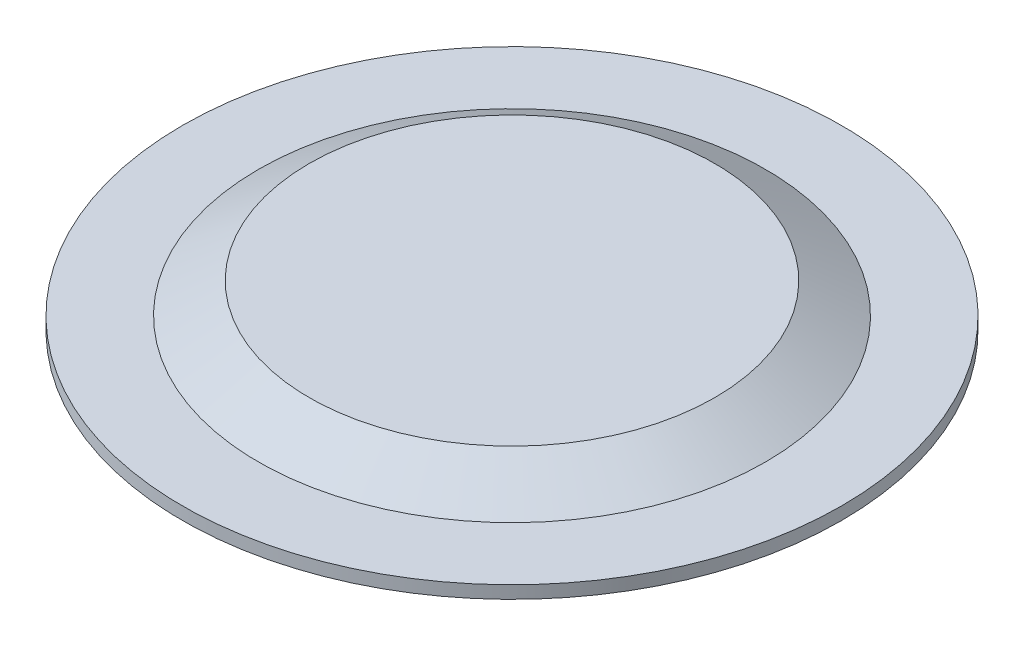
from build123d import *


with BuildPart() as part:
    # Sketch1 → Revolve1 (revolve)
    with BuildSketch(Plane.XY, mode=Mode.PRIVATE) as revolve1_sk:
        Polygon((-16.51, 0), (-12.524115182, 0), (-9.984115182, 1.524), (0, 1.524), (0, 2.159), (-10.16, 2.159), (-12.7, 0.635), (-16.51, 0.635), align=None)
    revolve(revolve1_sk.sketch.rotate(Axis((0, 0, 0), (0, 1, 0)), 180), axis=Axis((0, 0, 0), (0, 1, 0)))


solid = part.part
